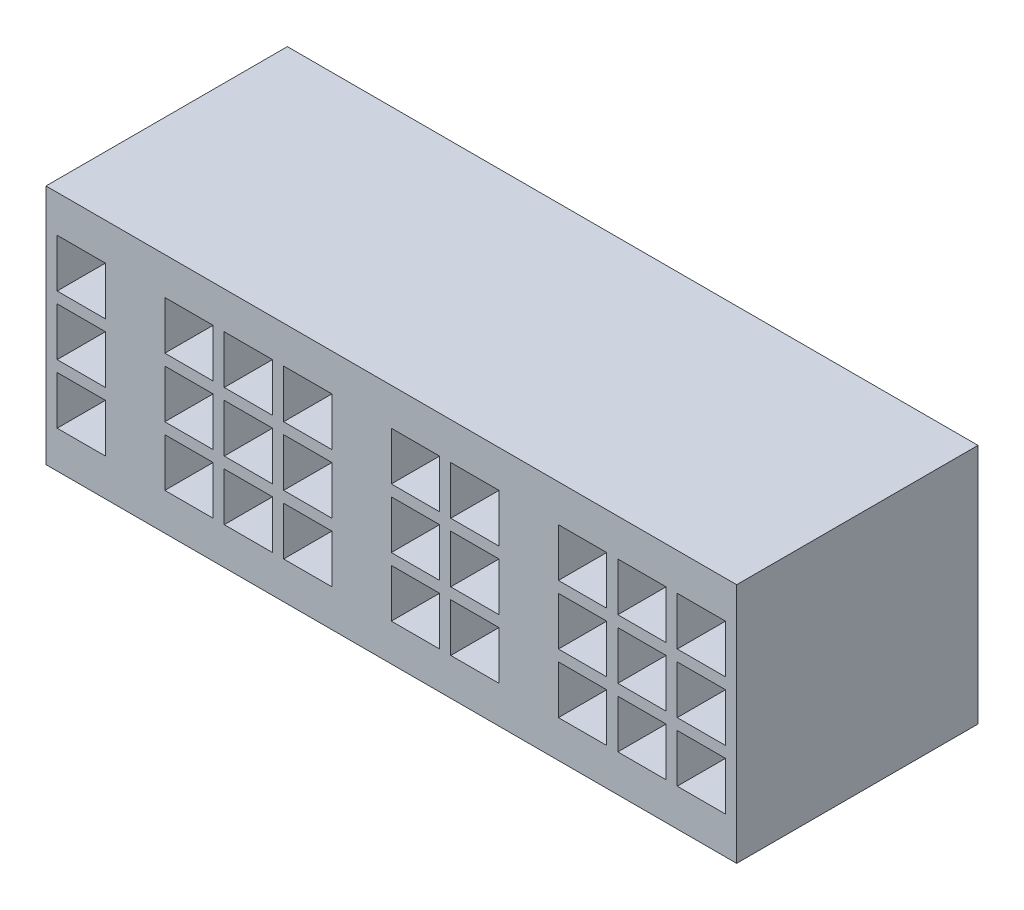
from build123d import *

# Parameters (mm, degrees)
ESQUISSE1_W                     = 186
ESQUISSE1_H                     = 51
BOSS_EXTRU_1_DEPTH              = 35
ESQUISSE7_W                     = 13
ESQUISSE7_H                     = 13
ENL_V_MAT_EXTRU_5_DEPTH         = 91
R_P_TITION_LIN_AIRE5_COUNT      = 3
R_P_TITION_LIN_AIRE5_PITCH      = 16
ESQUISSE8_W                     = 13
ESQUISSE8_H                     = 13
ENL_V_MAT_EXTRU_6_DEPTH         = 103
R_P_TITION_LIN_AIRE6_COUNT      = 3
R_P_TITION_LIN_AIRE6_PITCH      = 16
R_P_TITION_LIN_AIRE6_COUNT_DIR2 = 3
R_P_TITION_LIN_AIRE6_PITCH_DIR2 = 16
ESQUISSE9_W                     = 13
ESQUISSE9_H                     = 13
ENL_V_MAT_EXTRU_7_DEPTH         = 77
R_P_TITION_LIN_AIRE7_COUNT      = 3
R_P_TITION_LIN_AIRE7_PITCH      = 16
R_P_TITION_LIN_AIRE7_COUNT_DIR2 = 2
R_P_TITION_LIN_AIRE7_PITCH_DIR2 = 16
ESQUISSE10_W                    = 13
ESQUISSE10_H                    = 13
ENL_V_MAT_EXTRU_8_DEPTH         = 78
R_P_TITION_LIN_AIRE8_COUNT      = 3
R_P_TITION_LIN_AIRE8_PITCH      = 16
R_P_TITION_LIN_AIRE8_COUNT_DIR2 = 3
R_P_TITION_LIN_AIRE8_PITCH_DIR2 = 16
ESQUISSE14_W                    = 10
ESQUISSE14_H                    = 5
BOSS_EXTRU_3_DEPTH              = 7
ESQUISSE25_W                    = 186
ESQUISSE25_H                    = 35
BOSS_EXTRU_7_DEPTH              = 7
ESQUISSE18_W                    = 186
ESQUISSE18_H                    = 35
BOSS_EXTRU_5_DEPTH              = 7
ESQUISSE15_R                    = 1
ENL_V_MAT_EXTRU_10_DEPTH        = 7
ESQUISSE24_W                    = 10
ESQUISSE24_H                    = 2
ENL_V_MAT_EXTRU_12_DEPTH        = 1
ESQUISSE19_W                    = 186
ESQUISSE19_H                    = 1
ESQUISSE19_W_2                  = 1
ESQUISSE19_H_2                  = 63
BOSS_EXTRU_8_DEPTH              = 30
ESQUISSE26_R                    = 1.75
ENL_V_MAT_EXTRU_14_DEPTH        = 30


with BuildPart() as part:
    # Esquisse1 → Boss.-Extru.1 (new body)
    with BuildSketch(Plane.XY):
        with Locations((0, -25.5)):
            Rectangle(ESQUISSE1_W, ESQUISSE1_H)
    extrude(amount=BOSS_EXTRU_1_DEPTH)

    # Esquisse7 → Enlèv. mat.-Extru.5 (cut)
    with BuildSketch(Plane.XY.offset(35)):
        with Locations((-83.5, -9.5)):
            Rectangle(ESQUISSE7_W, ESQUISSE7_H)
    enl_v_mat_extru_5 = extrude(amount=-ENL_V_MAT_EXTRU_5_DEPTH, mode=Mode.SUBTRACT)

    # Répétition linéaire5: Enlèv. mat.-Extru.5 ×3
    with Locations(*[(0, -i * R_P_TITION_LIN_AIRE5_PITCH, 0) for i in range(1, R_P_TITION_LIN_AIRE5_COUNT)]):
        add(enl_v_mat_extru_5, mode=Mode.SUBTRACT)

    # Esquisse8 → Enlèv. mat.-Extru.6 (cut)
    with BuildSketch(Plane.XY.offset(35)):
        with Locations((-54.5, -9.5)):
            Rectangle(ESQUISSE8_W, ESQUISSE8_H)
    enl_v_mat_extru_6 = extrude(amount=-ENL_V_MAT_EXTRU_6_DEPTH, mode=Mode.SUBTRACT)

    # Répétition linéaire6: Enl_v. mat.-Extru.6 3 × 3
    with Locations(*[(j * R_P_TITION_LIN_AIRE6_PITCH_DIR2, -i * R_P_TITION_LIN_AIRE6_PITCH, 0) for i in range(R_P_TITION_LIN_AIRE6_COUNT) for j in range(R_P_TITION_LIN_AIRE6_COUNT_DIR2) if (i, j) != (0, 0)]):
        add(enl_v_mat_extru_6, mode=Mode.SUBTRACT)

    # Esquisse9 → Enlèv. mat.-Extru.7 (cut)
    with BuildSketch(Plane.XY.offset(35)):
        with Locations((6.5, -9.5)):
            Rectangle(ESQUISSE9_W, ESQUISSE9_H)
    enl_v_mat_extru_7 = extrude(amount=-ENL_V_MAT_EXTRU_7_DEPTH, mode=Mode.SUBTRACT)

    # Répétition linéaire7: Enl_v. mat.-Extru.7 3 × 2
    with Locations(*[(j * R_P_TITION_LIN_AIRE7_PITCH_DIR2, -i * R_P_TITION_LIN_AIRE7_PITCH, 0) for i in range(R_P_TITION_LIN_AIRE7_COUNT) for j in range(R_P_TITION_LIN_AIRE7_COUNT_DIR2) if (i, j) != (0, 0)]):
        add(enl_v_mat_extru_7, mode=Mode.SUBTRACT)

    # Esquisse10 → Enlèv. mat.-Extru.8 (cut)
    with BuildSketch(Plane.XY.offset(35)):
        with Locations((51.5, -9.5)):
            Rectangle(ESQUISSE10_W, ESQUISSE10_H)
    enl_v_mat_extru_8 = extrude(amount=-ENL_V_MAT_EXTRU_8_DEPTH, mode=Mode.SUBTRACT)

    # Répétition linéaire8: Enl_v. mat.-Extru.8 3 × 3
    with Locations(*[(i * R_P_TITION_LIN_AIRE8_PITCH, -j * R_P_TITION_LIN_AIRE8_PITCH_DIR2, 0) for i in range(R_P_TITION_LIN_AIRE8_COUNT) for j in range(R_P_TITION_LIN_AIRE8_COUNT_DIR2) if (i, j) != (0, 0)]):
        add(enl_v_mat_extru_8, mode=Mode.SUBTRACT)

    # Esquisse14 → Boss.-Extru.3 (add)
    with BuildSketch(Plane.XZ.offset(51)):
        with Locations((-7.663083533, 2.5)):
            Rectangle(ESQUISSE14_W, ESQUISSE14_H)
    extrude(amount=BOSS_EXTRU_3_DEPTH)

    # Esquisse25 → Boss.-Extru.7 (add)
    with BuildSketch(Plane(origin=(0, 0, 0), x_dir=(1, 0, 0), z_dir=(0, 1, 0))):
        with Locations((0, -17.5)):
            Rectangle(ESQUISSE25_W, ESQUISSE25_H)
    extrude(amount=BOSS_EXTRU_7_DEPTH)

    # Esquisse18 → Boss.-Extru.5 (add)
    with BuildSketch(Plane.XZ.offset(51)):
        with Locations((0, 17.5)):
            Rectangle(ESQUISSE18_W, ESQUISSE18_H)
    extrude(amount=BOSS_EXTRU_5_DEPTH)

    # Esquisse15 → Enlèv. mat.-Extru.10 (cut)
    with BuildSketch(Plane(origin=(0, 0, 0), x_dir=(-1, 0, 0), z_dir=(0, 0, -1))):
        with Locations((8.482305804, -42.446555864)):
            Circle(ESQUISSE15_R)
        with Locations((8.482305804, -9.749028666)):
            Circle(ESQUISSE15_R)
        with Locations((68.823038652, -42.446555864)):
            Circle(ESQUISSE15_R)
        with Locations((68.823038652, -9.749028666)):
            Circle(ESQUISSE15_R)
        with Locations((-37.13548256, -42.446555864)):
            Circle(ESQUISSE15_R)
        with Locations((-39.215855023, -11.260648292)):
            Circle(ESQUISSE15_R)
    extrude(amount=-ENL_V_MAT_EXTRU_10_DEPTH, mode=Mode.SUBTRACT)

    # Esquisse24 → Enlèv. mat.-Extru.12 (cut)
    with BuildSketch(Plane(origin=(0, 0, 0), x_dir=(-1, 0, 0), z_dir=(0, 0, -1))):
        with Locations((83.5, -49)):
            Rectangle(ESQUISSE24_W, ESQUISSE24_H)
        with Locations((54.5, -49)):
            Rectangle(ESQUISSE24_W, ESQUISSE24_H)
        with Locations((38.5, -49)):
            Rectangle(ESQUISSE24_W, ESQUISSE24_H)
        with Locations((22.5, -49)):
            Rectangle(ESQUISSE24_W, ESQUISSE24_H)
        with Locations((-6.5, -49)):
            Rectangle(ESQUISSE24_W, ESQUISSE24_H)
        with Locations((-22.5, -49)):
            Rectangle(ESQUISSE24_W, ESQUISSE24_H)
        with Locations((-51.5, -49)):
            Rectangle(ESQUISSE24_W, ESQUISSE24_H)
        with Locations((-67.5, -49)):
            Rectangle(ESQUISSE24_W, ESQUISSE24_H)
        with Locations((-83.5, -49)):
            Rectangle(ESQUISSE24_W, ESQUISSE24_H)
        with Locations((-83.5, -2)):
            Rectangle(ESQUISSE24_W, ESQUISSE24_H)
        with Locations((-67.5, -2)):
            Rectangle(ESQUISSE24_W, ESQUISSE24_H)
        with Locations((-51.5, -2)):
            Rectangle(ESQUISSE24_W, ESQUISSE24_H)
        with Locations((-22.5, -2)):
            Rectangle(ESQUISSE24_W, ESQUISSE24_H)
        with Locations((-6.5, -2)):
            Rectangle(ESQUISSE24_W, ESQUISSE24_H)
        with Locations((22.5, -2)):
            Rectangle(ESQUISSE24_W, ESQUISSE24_H)
        with Locations((38.5, -2)):
            Rectangle(ESQUISSE24_W, ESQUISSE24_H)
        with Locations((54.5, -2)):
            Rectangle(ESQUISSE24_W, ESQUISSE24_H)
        with Locations((83.5, -2)):
            Rectangle(ESQUISSE24_W, ESQUISSE24_H)
    extrude(amount=-ENL_V_MAT_EXTRU_12_DEPTH, mode=Mode.SUBTRACT)

    # Esquisse19 → Boss.-Extru.8 (add)
    with BuildSketch(Plane(origin=(0, 0, 0), x_dir=(-1, 0, 0), z_dir=(0, 0, -1))):
        with Locations((0, -57.5)):
            Rectangle(ESQUISSE19_W, ESQUISSE19_H)
        with Locations((92.5, -25.5)):
            Rectangle(ESQUISSE19_W_2, ESQUISSE19_H_2)
        with Locations((0, 6.5)):
            Rectangle(ESQUISSE19_W, ESQUISSE19_H)
        with Locations((-92.5, -25.5)):
            Rectangle(ESQUISSE19_W_2, ESQUISSE19_H_2)
    extrude(amount=BOSS_EXTRU_8_DEPTH)

    # Esquisse26 → Enlèv. mat.-Extru.14 (cut)
    with BuildSketch(Plane.ZY.offset(93)):
        with Locations((-13.75, -25.5)):
            Circle(ESQUISSE26_R)
    extrude(amount=-ENL_V_MAT_EXTRU_14_DEPTH, mode=Mode.SUBTRACT)


solid = part.part
